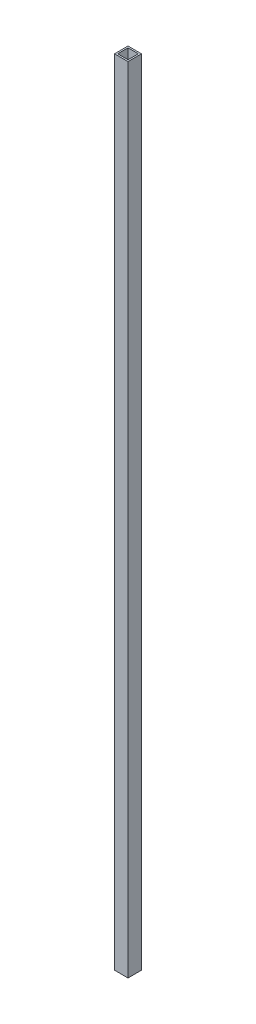
from build123d import *

# Parameters (mm, degrees)
SKETCH1_W           = 8.5
SKETCH1_H           = 8.5
SKETCH1_W_2         = 6.5
SKETCH1_H_2         = 6.5
BOSS_EXTRUDE1_DEPTH = 500


with BuildPart() as part:
    # Sketch1 → Boss-Extrude1 (new body)
    with BuildSketch(Plane(origin=(0, 0, 0), x_dir=(1, 0, 0), z_dir=(0, 1, 0))):
        with Locations((20.126704545, 26.085227273)):
            Rectangle(SKETCH1_W, SKETCH1_H)
        with Locations((20.126704545, 26.085227273)):
            Rectangle(SKETCH1_W_2, SKETCH1_H_2, mode=Mode.SUBTRACT)
    extrude(amount=BOSS_EXTRUDE1_DEPTH)


solid = part.part
